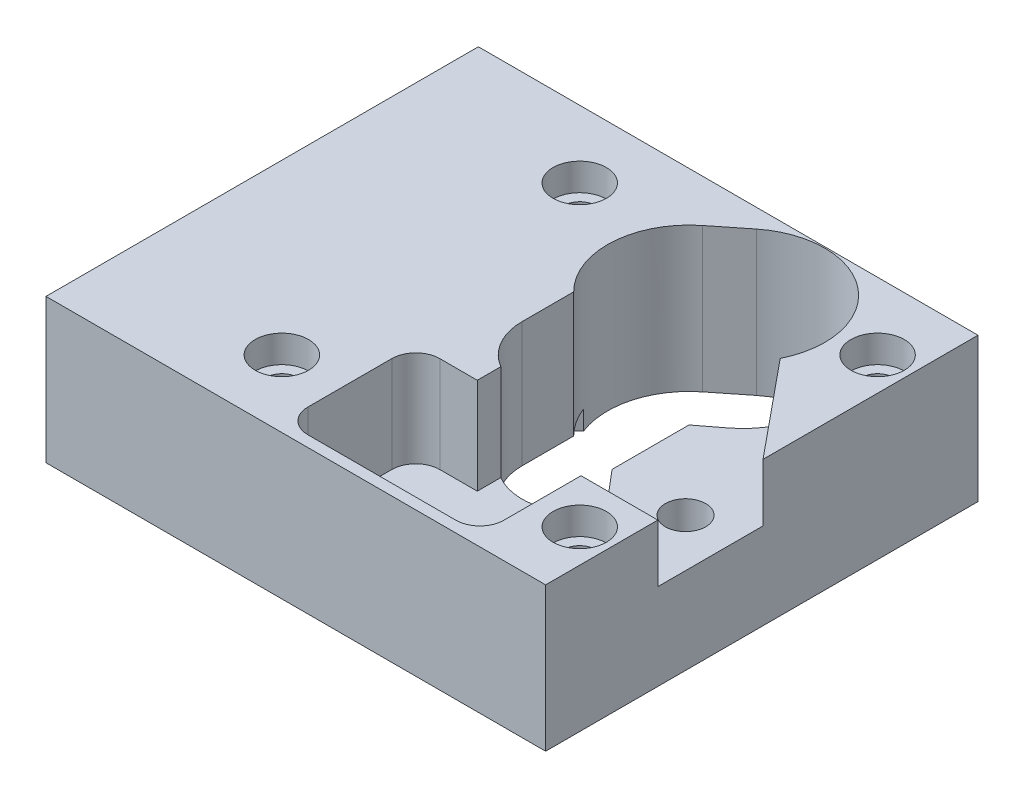
from build123d import *

# Parameters (mm, degrees)
SKETCH1_W                                      = 52
SKETCH1_H                                      = 45
BOSS_EXTRUDE1_DEPTH                            = 15
SKETCH2_R                                      = 11.5
CUT_EXTRUDE1_DEPTH                             = 2
CBORE_FOR_4_SOCKET_HEAD_CAP_SCREW1_D           = 3.2639
CBORE_FOR_4_SOCKET_HEAD_CAP_SCREW1_CBORE_D     = 5.55752
CBORE_FOR_4_SOCKET_HEAD_CAP_SCREW1_CBORE_DEPTH = 2.8448
CUT_EXTRUDE3_DEPTH                             = 71.384657419
CUT_EXTRUDE4_DEPTH                             = 10
CUT_EXTRUDE5_DEPTH                             = 6
M5_TAPPED_HOLE3_D                              = 4.2


with BuildPart() as part:
    # Sketch1 → Boss-Extrude1 (new body)
    with BuildSketch(Plane(origin=(0, 0, 0), x_dir=(1, 0, 0), z_dir=(0, 1, 0))):
        with Locations((26, 22.5)):
            Rectangle(SKETCH1_W, SKETCH1_H)
    extrude(amount=BOSS_EXTRUDE1_DEPTH)

    # Sketch2 → Cut-Extrude1 (cut)
    with BuildSketch(Plane.XZ):
        with Locations((33.048851489, -22.5)):
            Circle(SKETCH2_R)
    extrude(amount=-CUT_EXTRUDE1_DEPTH, mode=Mode.SUBTRACT)

    # CBORE for #4 Socket Head Cap Screw1 (through all)
    with Locations(Plane(origin=(0, 15, 0), x_dir=(-1, 0, 0), z_dir=(0, 1, 0))):
        with Locations((-48.548851489, -38), (-48.548851489, -7), (-17.548851489, -7), (-17.548851489, -38)):
            CounterBoreHole(CBORE_FOR_4_SOCKET_HEAD_CAP_SCREW1_D / 2, CBORE_FOR_4_SOCKET_HEAD_CAP_SCREW1_CBORE_D / 2, CBORE_FOR_4_SOCKET_HEAD_CAP_SCREW1_CBORE_DEPTH)

    # Sketch8 → Cut-Extrude3 (cut, through all)
    with BuildSketch(Plane(origin=(0, 15, 0), x_dir=(1, 0, 0), z_dir=(0, 1, 0))):
        with BuildLine():
            Line((27.048851489, 22.5), (27.048851489, 27.869202711))
            ThreePointArc((27.048851489, 27.869202711), (24.562140957, 34.365125617), (27.7583836, 40.542890313))
            Line((27.7583836, 40.542890313), (30.889155511, 43.032522261))
            ThreePointArc((30.889155511, 43.032522261), (42.879465836, 41.610512499), (41.350499943, 29.633371074))
            Line((41.350499943, 29.633371074), (39.048851489, 27.869202711))
            Line((39.048851489, 27.869202711), (39.048851489, 22.5))
            ThreePointArc((39.048851489, 22.5), (33.048851489, 16.5), (27.048851489, 22.5))
        make_face()
    extrude(amount=-CUT_EXTRUDE3_DEPTH, mode=Mode.SUBTRACT)

    # Sketch11 → Cut-Extrude4 (cut)
    with BuildSketch(Plane(origin=(0, 15, 0), x_dir=(1, 0, 0), z_dir=(0, 1, 0))):
        with BuildLine():
            Line((23.601490667, 12.384290412), (23.601490667, 3.652513208))
            ThreePointArc((23.601490667, 3.652513208), (24.333723714, 1.884746256), (26.101490667, 1.152513208))
            Line((26.101490667, 1.152513208), (41.505460803, 1.152513208))
            ThreePointArc((41.505460803, 1.152513208), (43.273227756, 1.884746256), (44.005460803, 3.652513208))
            Line((44.005460803, 3.652513208), (44.005460803, 13.09315188))
            ThreePointArc((44.005460803, 13.09315188), (43.852771156, 13.953462349), (43.41335352, 14.708684417))
            Line((43.41335352, 14.708684417), (39.048851489, 19.863022972))
            Line((39.048851489, 19.863022972), (39.048851489, 34.725308874))
            Line((39.048851489, 34.725308874), (27.048851489, 34.725308874))
            Line((27.048851489, 34.725308874), (27.048851489, 22.5))
            ThreePointArc((27.048851489, 22.5), (27.839413547, 19.523129776), (30.002770266, 17.330726436))
            Line((30.002770266, 17.330726436), (30.002770266, 14.884290412))
            Line((30.002770266, 14.884290412), (26.101490667, 14.884290412))
            ThreePointArc((26.101490667, 14.884290412), (24.333723714, 14.152057365), (23.601490667, 12.384290412))
        make_face()
    extrude(amount=-CUT_EXTRUDE4_DEPTH, mode=Mode.SUBTRACT)

    # Sketch12 → Cut-Extrude5 (cut)
    with BuildSketch(Plane(origin=(0, 15, 0), x_dir=(1, 0, 0), z_dir=(0, 1, 0))):
        Polygon((43.546506973, 11.676957706), (53.351680383, 11.676957706), (53.351680383, 20.978390716), (41.522528086, 35.389540724), (36.326040528, 27.362061402), (38.483158835, 17.285853694), align=None)
    extrude(amount=-CUT_EXTRUDE5_DEPTH, mode=Mode.SUBTRACT)

    # M5 Tapped Hole3 (through all)
    with Locations(Plane(origin=(0, 15, 0), x_dir=(-1, 0, 0), z_dir=(0, 1, 0))):
        with Locations((-47, -19.55942237)):
            Hole(M5_TAPPED_HOLE3_D / 2)


solid = part.part
